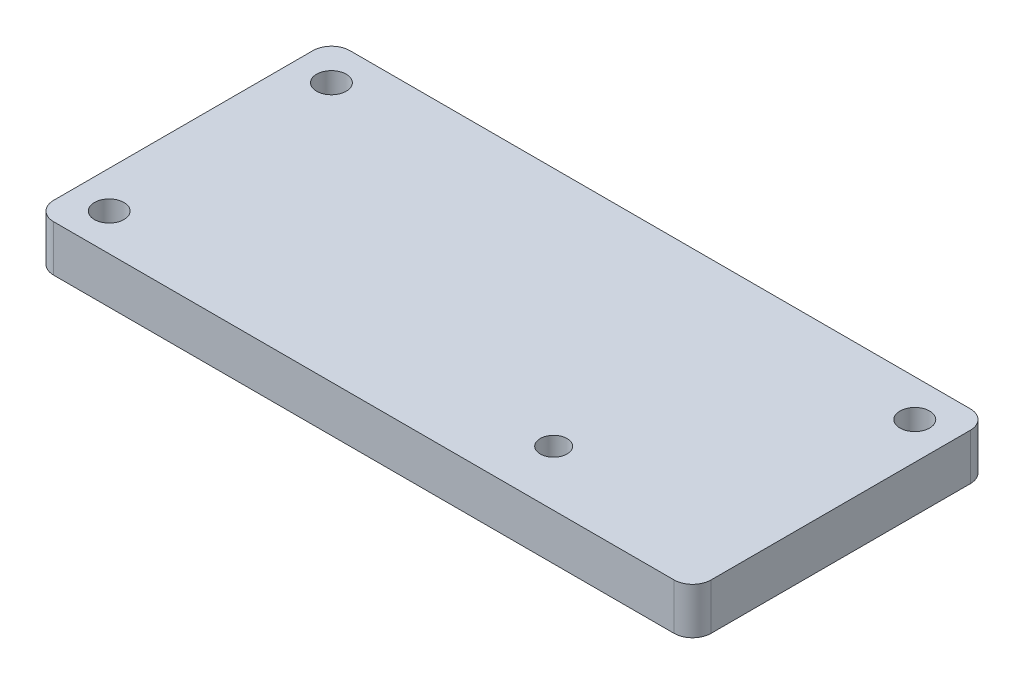
from build123d import *

# Parameters (mm, degrees)
SKETCH_1_W          = 71
SKETCH_1_H          = 32
SKETCH_1_R          = 1.45
EXTRUDE_1_DEPTH     = 5
SKETCH_2_R          = 1.6
CUT_EXTRUDE_1_DEPTH = 5
FILLET_1_R          = 2


with BuildPart() as part:
    # 草图1 → 凸台-拉伸1 (new body)
    with BuildSketch(Plane(origin=(0, 0, 0), x_dir=(1, 0, 0), z_dir=(0, 1, 0))):
        Rectangle(SKETCH_1_W, SKETCH_1_H)
        with Locations(Location((14.5, -10, 0), (0, 0, 270))):
            Circle(SKETCH_1_R, mode=Mode.SUBTRACT)
    extrude(amount=EXTRUDE_1_DEPTH)

    # 草图2 → 切除-拉伸1 (cut)
    with BuildSketch(Plane(origin=(0, 5, 0), x_dir=(1, 0, 0), z_dir=(0, 1, 0))):
        with Locations(Location((-31.5, 12, 0), (0, 0, 270))):
            Circle(SKETCH_2_R)
        with Locations(Location((-31.5, -12, 0), (0, 0, 270))):
            Circle(SKETCH_2_R)
        with Locations(Location((31.5, 12, 0), (0, 0, 270))):
            Circle(SKETCH_2_R)
    extrude(amount=-CUT_EXTRUDE_1_DEPTH, mode=Mode.SUBTRACT)

    # 圆角1
    fillet_1_edges = [part.edges().sort_by_distance(p)[0] for p in [
        (35.5, 2.5, 16),
        (-35.5, 2.5, 16),
        (-35.5, 2.5, -16),
        (35.5, 2.5, -16),
    ]]
    fillet(fillet_1_edges, radius=FILLET_1_R)


solid = part.part
